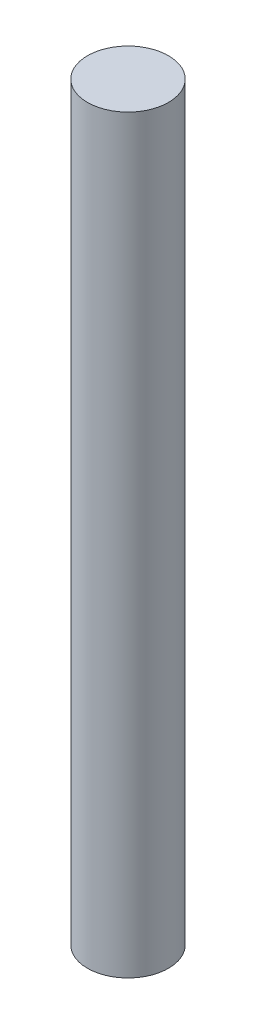
from build123d import *

# Parameters (mm, degrees)
SKETCH1_R           = 1.35
BOSS_EXTRUDE1_DEPTH = 25


with BuildPart() as part:
    # Sketch1 → Boss-Extrude1 (new body)
    with BuildSketch(Plane(origin=(0, 0, 0), x_dir=(1, 0, 0), z_dir=(0, 1, 0))):
        Circle(SKETCH1_R)
    extrude(amount=BOSS_EXTRUDE1_DEPTH)


solid = part.part
